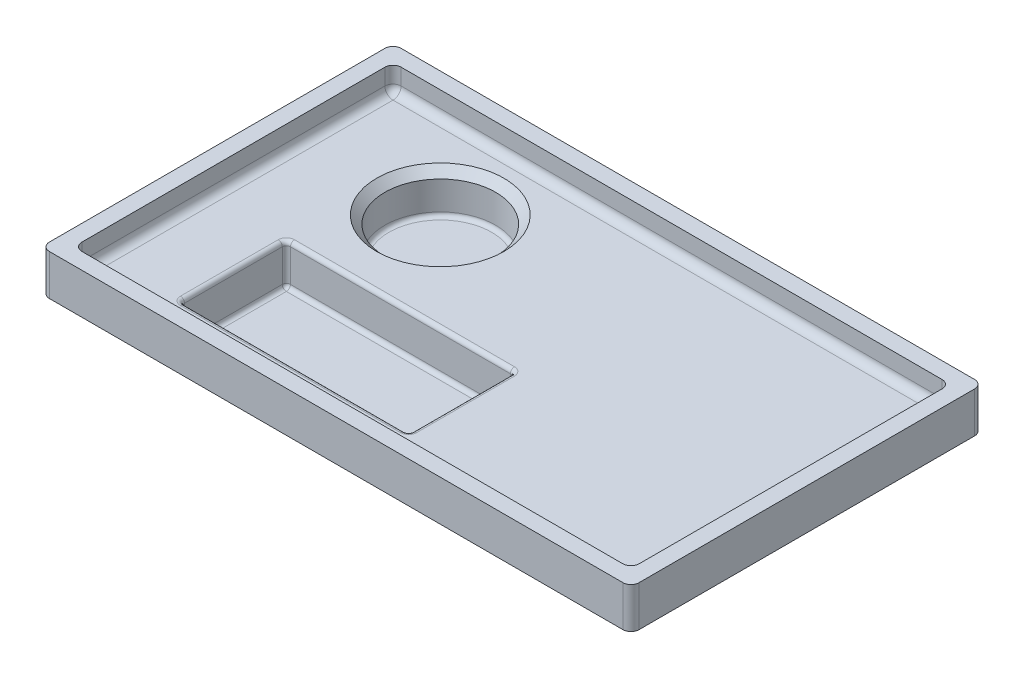
from build123d import *

# Parameters (mm, degrees)
SKETCH1_W           = 361.95
SKETCH1_H           = 215.9
BOSS_EXTRUDE1_DEPTH = 10
FILLET1_R           = 5
BOSS_EXTRUDE2_START = 15
BOSS_EXTRUDE2_DEPTH = 15
FILLET2_R           = 5
SKETCH3_R           = 38.02
BOSS_EXTRUDE3_DEPTH = 30
SKETCH4_R           = 34.02
CUT_EXTRUDE1_DEPTH  = 25
CHAMFER1_SIZE       = 15
CHAMFER2_SIZE       = 5
FILLET3_R           = 2.5
SKETCH6_W           = 150
SKETCH6_H           = 75
BOSS_EXTRUDE4_DEPTH = 20
SKETCH5_W           = 140
SKETCH5_H           = 65
CUT_EXTRUDE2_DEPTH  = 25
FILLET4_R           = 2.5
FILLET5_R           = 2.5


with BuildPart() as part:
    # Sketch1 → Boss-Extrude1 (new body)
    with BuildSketch(Plane(origin=(0, 0, 0), x_dir=(1, 0, 0), z_dir=(0, 1, 0))):
        Rectangle(SKETCH1_W, SKETCH1_H)
    extrude(amount=BOSS_EXTRUDE1_DEPTH)

    # Fillet1
    fillet1_edges = [part.edges().sort_by_distance(p)[0] for p in [
        (-180.975, 5, 107.95),
        (-180.975, 5, -107.95),
        (180.975, 5, -107.95),
        (180.975, 5, 107.95),
    ]]
    fillet(fillet1_edges, radius=FILLET1_R)

    # Sketch2 → Boss-Extrude2 (add)
    with BuildSketch(Plane(origin=(0, 10, 0), x_dir=(1, 0, 0), z_dir=(0, 1, 0)).offset(BOSS_EXTRUDE2_START)):
        with BuildLine():
            Line((-175.975, -107.95), (175.975, -107.95))
            ThreePointArc((175.975, -107.95), (179.510533906, -106.485533906), (180.975, -102.95))
            Line((180.975, -102.95), (180.975, 102.95))
            ThreePointArc((180.975, 102.95), (179.510533906, 106.485533906), (175.975, 107.95))
            Line((175.975, 107.95), (-175.975, 107.95))
            ThreePointArc((-175.975, 107.95), (-179.510533906, 106.485533906), (-180.975, 102.95))
            Line((-180.975, 102.95), (-180.975, -102.95))
            ThreePointArc((-180.975, -102.95), (-179.510533906, -106.485533906), (-175.975, -107.95))
        make_face()
        with BuildLine():
            Line((-165.975, -97.95), (165.975, -97.95))
            ThreePointArc((165.975, -97.95), (169.510533906, -96.485533906), (170.975, -92.95))
            Line((170.975, -92.95), (170.975, 92.95))
            ThreePointArc((170.975, 92.95), (169.510533906, 96.485533906), (165.975, 97.95))
            Line((165.975, 97.95), (-165.975, 97.95))
            ThreePointArc((-165.975, 97.95), (-169.510533906, 96.485533906), (-170.975, 92.95))
            Line((-170.975, 92.95), (-170.975, -92.95))
            ThreePointArc((-170.975, -92.95), (-169.510533906, -96.485533906), (-165.975, -97.95))
        make_face(mode=Mode.SUBTRACT)
    extrude(amount=-BOSS_EXTRUDE2_DEPTH)

    # Fillet2
    fillet2_edges = [part.edges().sort_by_distance(p)[0] for p in [
        (0, 10, 97.95),
        (169.510533906, 10, 96.485533906),
        (170.975, 10, 0),
        (169.510533906, 10, -96.485533906),
        (0, 10, -97.95),
        (-169.510533906, 10, -96.485533906),
        (-170.975, 10, 0),
        (-169.510533906, 10, 96.485533906),
    ]]
    fillet(fillet2_edges, radius=FILLET2_R)

    # Sketch3 → Boss-Extrude3 (add)
    with BuildSketch(Plane(origin=(0, 10, 0), x_dir=(1, 0, 0), z_dir=(0, 1, 0))):
        with Locations(Location((-90.4875, 46.475, 0), (0, 0, 270))):
            Circle(SKETCH3_R)
    extrude(amount=-BOSS_EXTRUDE3_DEPTH)

    # Sketch4 → Cut-Extrude1 (cut)
    with BuildSketch(Plane(origin=(0, 10, 0), x_dir=(1, 0, 0), z_dir=(0, 1, 0))):
        with Locations(Location((-90.4875, 46.475, 0), (0, 0, 270))):
            Circle(SKETCH4_R)
    extrude(amount=-CUT_EXTRUDE1_DEPTH, mode=Mode.SUBTRACT)

    # Chamfer1
    chamfer1_edges = [part.edges().sort_by_distance(p)[0] for p in [
        (-90.4875, 0, -84.495),
    ]]
    chamfer(chamfer1_edges, length=CHAMFER1_SIZE)

    # Chamfer2
    chamfer2_edges = [part.edges().sort_by_distance(p)[0] for p in [
        (-90.4875, 10, -80.495),
    ]]
    chamfer(chamfer2_edges, length=CHAMFER2_SIZE)

    # Fillet3
    fillet3_edges = [part.edges().sort_by_distance(p)[0] for p in [
        (-90.4875, -15, -80.495),
    ]]
    fillet(fillet3_edges, radius=FILLET3_R)

    # Sketch6 → Boss-Extrude4 (add)
    with BuildSketch(Plane.XZ):
        with Locations((-54.5075, 46.475)):
            Rectangle(SKETCH6_W, SKETCH6_H)
    extrude(amount=BOSS_EXTRUDE4_DEPTH)

    # Sketch5 → Cut-Extrude2 (cut)
    with BuildSketch(Plane(origin=(0, 10, 0), x_dir=(1, 0, 0), z_dir=(0, 1, 0))):
        with Locations((-54.5075, -46.475)):
            Rectangle(SKETCH5_W, SKETCH5_H)
    extrude(amount=-CUT_EXTRUDE2_DEPTH, mode=Mode.SUBTRACT)

    # Fillet4
    fillet4_edges = [part.edges().sort_by_distance(p)[0] for p in [
        (-129.5075, -20, 46.475),
        (-129.5075, -10, 83.975),
        (-54.5075, 0, 8.975),
        (-129.5075, -10, 8.975),
        (20.4925, 0, 46.475),
        (20.4925, -10, 8.975),
        (-54.5075, -20, 83.975),
        (20.4925, -10, 83.975),
        (-54.5075, -20, 8.975),
        (20.4925, -20, 46.475),
        (-129.5075, 0, 46.475),
        (-54.5075, 0, 83.975),
    ]]
    fillet(fillet4_edges, radius=FILLET4_R)

    # Fillet5
    fillet5_edges = [part.edges().sort_by_distance(p)[0] for p in [
        (-54.5075, 10, 13.975),
        (-124.5075, -2.5, 13.975),
        (15.4925, 10, 46.475),
        (15.4925, -2.5, 13.975),
        (-54.5075, -15, 78.975),
        (15.4925, -2.5, 78.975),
        (-124.5075, -15, 46.475),
        (-124.5075, -2.5, 78.975),
        (-54.5075, -15, 13.975),
        (15.4925, -15, 46.475),
        (-124.5075, 10, 46.475),
        (-54.5075, 10, 78.975),
    ]]
    fillet(fillet5_edges, radius=FILLET5_R)


solid = part.part
